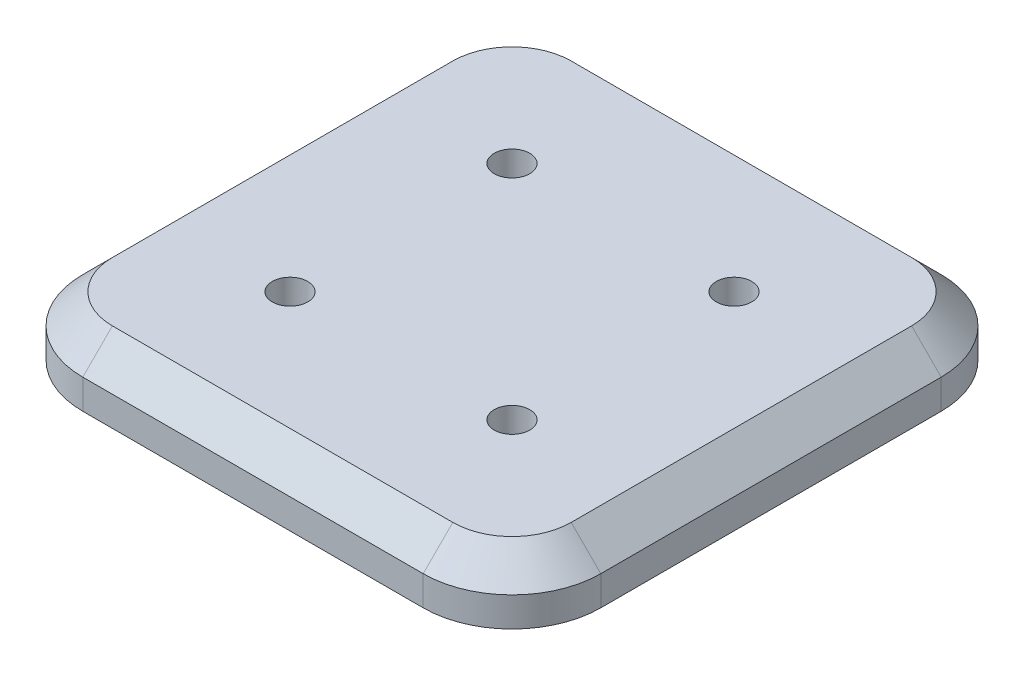
from build123d import *

# Parameters (mm, degrees)
BOSS_EXTRUDE1_DEPTH = 10
CHAMFER1_SIZE       = 10
SKETCH2_R           = 6
CUT_EXTRUDE1_DEPTH  = 10
SKETCH3_R           = 6
CUT_EXTRUDE2_DEPTH  = 10


with BuildPart() as part:
    # Sketch1 → Boss-Extrude1 (new, symmetric)
    with BuildSketch(Plane(origin=(0, 0, 0), x_dir=(1, 0, 0), z_dir=(0, 1, 0))):
        with BuildLine():
            Line((-57.5, 87.5), (57.5, 87.5))
            ThreePointArc((57.5, 87.5), (78.713203436, 78.713203436), (87.5, 57.5))
            Line((87.5, 57.5), (87.5, -57.5))
            ThreePointArc((87.5, -57.5), (78.713203436, -78.713203436), (57.5, -87.5))
            Line((57.5, -87.5), (-57.5, -87.5))
            ThreePointArc((-57.5, -87.5), (-78.713203436, -78.713203436), (-87.5, -57.5))
            Line((-87.5, -57.5), (-87.5, 57.5))
            ThreePointArc((-87.5, 57.5), (-78.713203436, 78.713203436), (-57.5, 87.5))
        make_face()
    extrude(amount=BOSS_EXTRUDE1_DEPTH, both=True)

    # Chamfer1
    chamfer1_edges = [part.edges().sort_by_distance(p)[0] for p in [
        (78.713203436, 10, 78.713203436),
        (87.5, 10, 0),
        (78.713203436, 10, -78.713203436),
        (0, 10, -87.5),
        (-78.713203436, 10, -78.713203436),
        (-87.5, 10, 0),
        (-78.713203436, 10, 78.713203436),
        (0, 10, 87.5),
    ]]
    chamfer(chamfer1_edges, length=CHAMFER1_SIZE)

    # Sketch2 → Cut-Extrude1 (cut)
    with BuildSketch(Plane(origin=(0, 10, 0), x_dir=(1, 0, 0), z_dir=(0, 1, 0))):
        with Locations(Location((37.5, 37.5, 0), (0, 0, 270))):
            Circle(SKETCH2_R)
        with Locations(Location((-37.5, 37.5, 0), (0, 0, 90))):
            Circle(SKETCH2_R)
        with Locations(Location((37.5, -37.5, 0), (0, 0, 90))):
            Circle(SKETCH2_R)
        with Locations(Location((-37.5, -37.5, 0), (0, 0, 270))):
            Circle(SKETCH2_R)
    extrude(amount=-CUT_EXTRUDE1_DEPTH, mode=Mode.SUBTRACT)

    # Sketch3 → Cut-Extrude2 (cut)
    with BuildSketch(Plane.XZ.offset(10)):
        with Locations(Location((62.5, 62.5, 0), (0, 0, 270))):
            Circle(SKETCH3_R)
        with Locations(Location((-62.5, 62.5, 0), (0, 0, 270))):
            Circle(SKETCH3_R)
        with Locations(Location((62.5, -62.5, 0), (0, 0, 270))):
            Circle(SKETCH3_R)
        with Locations(Location((-62.5, -62.5, 0), (0, 0, 270))):
            Circle(SKETCH3_R)
    extrude(amount=-CUT_EXTRUDE2_DEPTH, mode=Mode.SUBTRACT)


solid = part.part
